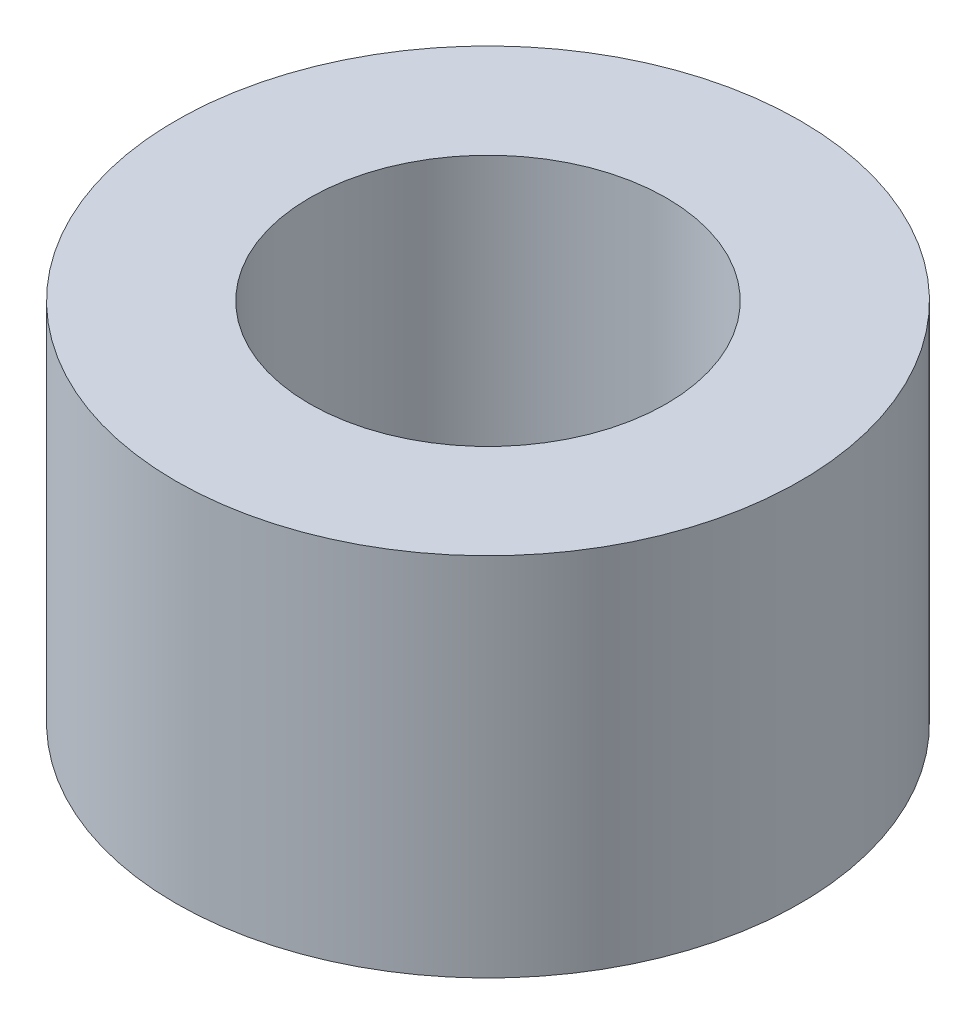
from build123d import *

# Parameters (mm, degrees)
SKETCH1_R           = 3.5
SKETCH1_R_2         = 2
BOSS_EXTRUDE1_DEPTH = 4.1


with BuildPart() as part:
    # Sketch1 → Boss-Extrude1 (new body)
    with BuildSketch(Plane(origin=(0, 0, 0), x_dir=(1, 0, 0), z_dir=(0, 1, 0))):
        with Locations(Location((0, 0, 0), (0, 0, 270))):
            Circle(SKETCH1_R)
        with Locations(Location((0, 0, 0), (0, 0, 270))):
            Circle(SKETCH1_R_2, mode=Mode.SUBTRACT)
    extrude(amount=BOSS_EXTRUDE1_DEPTH)


solid = part.part
